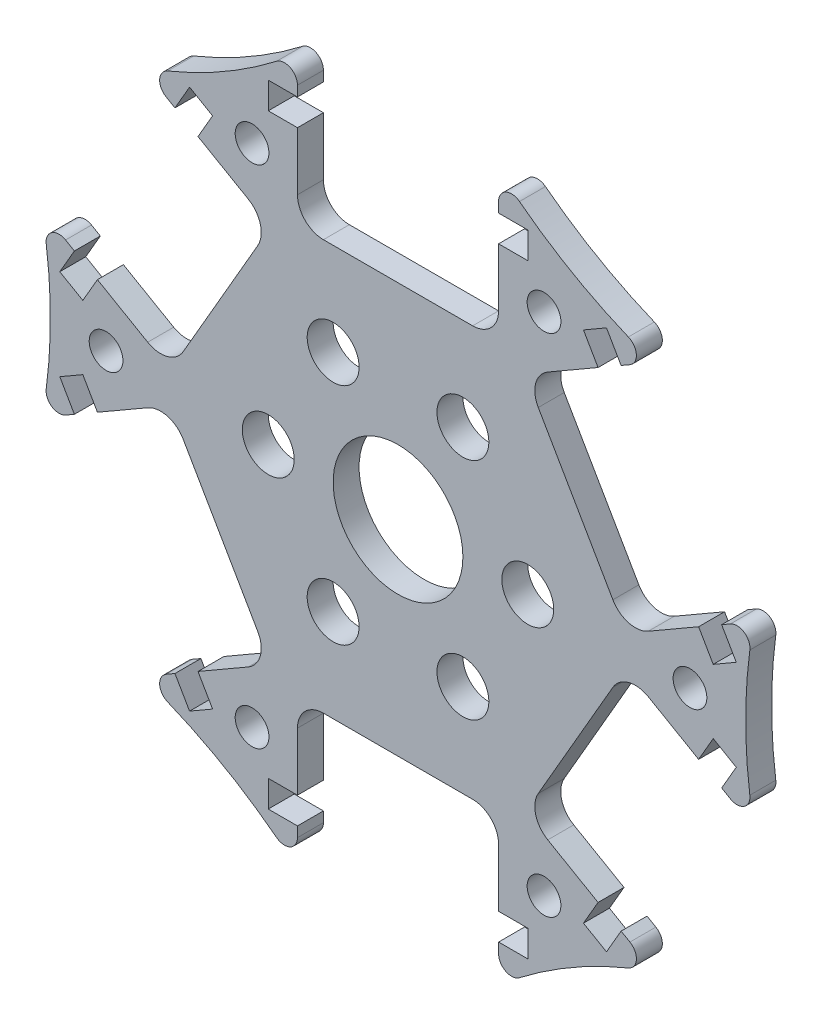
from build123d import *

# Parameters (mm, degrees)
SKETCH_1_R          = 28.3
EXTRUDE_1_DEPTH     = 2
SKETCH_2_R          = 5
SKETCH_2_R_2        = 2
SKETCH_2_R_3        = 1.3
CUT_EXTRUDE_1_DEPTH = 41.072184867
CUT_EXTRUDE_3_DEPTH = 40.315613947
FILLET_2_R          = 2
FILLET_1_R          = 1


with BuildPart() as part:
    # ｽｹｯﾁ1 → ﾎﾞｽ - 押し出し1 (new body)
    with BuildSketch(Plane.XY):
        Circle(SKETCH_1_R)
    extrude(amount=EXTRUDE_1_DEPTH)

    # ｽｹｯﾁ2 → ｶｯﾄ - 押し出し1 (cut, through all)
    with BuildSketch(Plane.XY.offset(2)):
        Circle(SKETCH_2_R)
        with Locations((5, 8.660254038)):
            Circle(SKETCH_2_R_2)
        with Locations((10, 0)):
            Circle(SKETCH_2_R_2)
        with Locations((5, -8.660254038)):
            Circle(SKETCH_2_R_2)
        with Locations((-5, -8.660254038)):
            Circle(SKETCH_2_R_2)
        with Locations((-10, 0)):
            Circle(SKETCH_2_R_2)
        with Locations((-5, 8.660254038)):
            Circle(SKETCH_2_R_2)
        with Locations((11.25, 19.485571585)):
            Circle(SKETCH_2_R_3)
        with Locations((22.5, 0)):
            Circle(SKETCH_2_R_3)
        with Locations((11.25, -19.485571585)):
            Circle(SKETCH_2_R_3)
        with Locations((-11.25, -19.485571585)):
            Circle(SKETCH_2_R_3)
        with Locations((-22.5, 0)):
            Circle(SKETCH_2_R_3)
        with Locations((-11.25, 19.485571585)):
            Circle(SKETCH_2_R_3)
        with BuildLine():
            Line((7.75, 24.325), (10, 24.325))
            Line((10, 24.325), (10, 22.275))
            Line((10, 22.275), (7.75, 22.275))
            Line((7.75, 22.275), (7.75, 15.8))
            Line((7.75, 15.8), (-7.75, 15.8))
            Line((-7.75, 15.8), (-7.75, 22.275))
            Line((-7.75, 22.275), (-10, 22.275))
            Line((-10, 22.275), (-10, 24.325))
            Line((-10, 24.325), (-7.75, 24.325))
            Line((-7.75, 24.325), (-7.75, 27.21814652))
            ThreePointArc((-7.75, 27.21814652), (0, 28.3), (7.75, 27.21814652))
            Line((7.75, 27.21814652), (7.75, 24.325))
        make_face()
        with BuildLine():
            Line((24.941067947, 5.450803121), (26.066067947, 3.502245962))
            Line((26.066067947, 3.502245962), (24.290715869, 2.477245962))
            Line((24.290715869, 2.477245962), (23.165715869, 4.425803121))
            Line((23.165715869, 4.425803121), (17.55820138, 1.188303121))
            Line((17.55820138, 1.188303121), (9.80820138, 14.611696879))
            Line((9.80820138, 14.611696879), (15.415715869, 17.849196879))
            Line((15.415715869, 17.849196879), (14.290715869, 19.797754038))
            Line((14.290715869, 19.797754038), (16.066067947, 20.822754038))
            Line((16.066067947, 20.822754038), (17.191067947, 18.874196879))
            Line((17.191067947, 18.874196879), (19.69660633, 20.320770139))
            ThreePointArc((19.69660633, 20.320770139), (24.508518927, 14.15), (27.44660633, 6.897376381))
            Line((27.44660633, 6.897376381), (24.941067947, 5.450803121))
        make_face()
        with BuildLine():
            Line((17.191067947, -18.874196879), (16.066067947, -20.822754038))
            Line((16.066067947, -20.822754038), (14.290715869, -19.797754038))
            Line((14.290715869, -19.797754038), (15.415715869, -17.849196879))
            Line((15.415715869, -17.849196879), (9.80820138, -14.611696879))
            Line((9.80820138, -14.611696879), (17.55820138, -1.188303121))
            Line((17.55820138, -1.188303121), (23.165715869, -4.425803121))
            Line((23.165715869, -4.425803121), (24.290715869, -2.477245962))
            Line((24.290715869, -2.477245962), (26.066067947, -3.502245962))
            Line((26.066067947, -3.502245962), (24.941067947, -5.450803121))
            Line((24.941067947, -5.450803121), (27.44660633, -6.897376381))
            ThreePointArc((27.44660633, -6.897376381), (24.508518927, -14.15), (19.69660633, -20.320770139))
            Line((19.69660633, -20.320770139), (17.191067947, -18.874196879))
        make_face()
        with BuildLine():
            Line((-7.75, -24.325), (-10, -24.325))
            Line((-10, -24.325), (-10, -22.275))
            Line((-10, -22.275), (-7.75, -22.275))
            Line((-7.75, -22.275), (-7.75, -15.8))
            Line((-7.75, -15.8), (7.75, -15.8))
            Line((7.75, -15.8), (7.75, -22.275))
            Line((7.75, -22.275), (10, -22.275))
            Line((10, -22.275), (10, -24.325))
            Line((10, -24.325), (7.75, -24.325))
            Line((7.75, -24.325), (7.75, -27.21814652))
            ThreePointArc((7.75, -27.21814652), (0, -28.3), (-7.75, -27.21814652))
            Line((-7.75, -27.21814652), (-7.75, -24.325))
        make_face()
        with BuildLine():
            Line((-24.941067947, -5.450803121), (-26.066067947, -3.502245962))
            Line((-26.066067947, -3.502245962), (-24.290715869, -2.477245962))
            Line((-24.290715869, -2.477245962), (-23.165715869, -4.425803121))
            Line((-23.165715869, -4.425803121), (-17.55820138, -1.188303121))
            Line((-17.55820138, -1.188303121), (-9.80820138, -14.611696879))
            Line((-9.80820138, -14.611696879), (-15.415715869, -17.849196879))
            Line((-15.415715869, -17.849196879), (-14.290715869, -19.797754038))
            Line((-14.290715869, -19.797754038), (-16.066067947, -20.822754038))
            Line((-16.066067947, -20.822754038), (-17.191067947, -18.874196879))
            Line((-17.191067947, -18.874196879), (-19.69660633, -20.320770139))
            ThreePointArc((-19.69660633, -20.320770139), (-24.508518927, -14.15), (-27.44660633, -6.897376381))
            Line((-27.44660633, -6.897376381), (-24.941067947, -5.450803121))
        make_face()
        with BuildLine():
            Line((-17.191067947, 18.874196879), (-16.066067947, 20.822754038))
            Line((-16.066067947, 20.822754038), (-14.290715869, 19.797754038))
            Line((-14.290715869, 19.797754038), (-15.415715869, 17.849196879))
            Line((-15.415715869, 17.849196879), (-9.80820138, 14.611696879))
            Line((-9.80820138, 14.611696879), (-17.55820138, 1.188303121))
            Line((-17.55820138, 1.188303121), (-23.165715869, 4.425803121))
            Line((-23.165715869, 4.425803121), (-24.290715869, 2.477245962))
            Line((-24.290715869, 2.477245962), (-26.066067947, 3.502245962))
            Line((-26.066067947, 3.502245962), (-24.941067947, 5.450803121))
            Line((-24.941067947, 5.450803121), (-27.44660633, 6.897376381))
            ThreePointArc((-27.44660633, 6.897376381), (-24.508518927, 14.15), (-19.69660633, 20.320770139))
            Line((-19.69660633, 20.320770139), (-17.191067947, 18.874196879))
        make_face()
    extrude(amount=-CUT_EXTRUDE_1_DEPTH, mode=Mode.SUBTRACT)

    # ｽｹｯﾁ3 → ｶｯﾄ - 押し出し3 (cut, through all)
    with BuildSketch(Plane.XY.offset(2)):
        with BuildLine():
            ThreePointArc((7.75, 27.21814652), (13.394592318, 23.200114441), (19.69660633, 20.320770139))
            ThreePointArc((19.69660633, 20.320770139), (14.15, 24.508518927), (7.75, 27.21814652))
        make_face()
        with BuildLine():
            ThreePointArc((27.44660633, 6.897376381), (26.789184636, 0), (27.44660633, -6.897376381))
            ThreePointArc((27.44660633, -6.897376381), (28.3, 0), (27.44660633, 6.897376381))
        make_face()
        with BuildLine():
            ThreePointArc((19.69660633, -20.320770139), (13.394592318, -23.200114441), (7.75, -27.21814652))
            ThreePointArc((7.75, -27.21814652), (14.15, -24.508518927), (19.69660633, -20.320770139))
        make_face()
        with BuildLine():
            ThreePointArc((-7.75, -27.21814652), (-13.394592318, -23.200114441), (-19.69660633, -20.320770139))
            ThreePointArc((-19.69660633, -20.320770139), (-14.15, -24.508518927), (-7.75, -27.21814652))
        make_face()
        with BuildLine():
            ThreePointArc((-27.44660633, -6.897376381), (-26.789184636, 0), (-27.44660633, 6.897376381))
            ThreePointArc((-27.44660633, 6.897376381), (-28.3, 0), (-27.44660633, -6.897376381))
        make_face()
        with BuildLine():
            ThreePointArc((-19.69660633, 20.320770139), (-13.394592318, 23.200114441), (-7.75, 27.21814652))
            ThreePointArc((-7.75, 27.21814652), (-14.15, 24.508518927), (-19.69660633, 20.320770139))
        make_face()
    extrude(amount=-CUT_EXTRUDE_3_DEPTH, mode=Mode.SUBTRACT)

    # ﾌｨﾚｯﾄ2
    fillet_2_edges = [part.edges().sort_by_distance(p)[0] for p in [
        (9.80820138, -14.611696879, 1),
        (17.55820138, -1.188303121, 1),
        (17.55820138, 1.188303121, 1),
        (9.80820138, 14.611696879, 1),
        (7.75, 15.8, 1),
        (-7.75, 15.8, 1),
        (-9.80820138, 14.611696879, 1),
        (-17.55820138, 1.188303121, 1),
        (-7.75, -15.8, 1),
        (7.75, -15.8, 1),
        (-17.55820138, -1.188303121, 1),
        (-9.80820138, -14.611696879, 1),
    ]]
    fillet(fillet_2_edges, radius=FILLET_2_R)

    # ﾌｨﾚｯﾄ1
    fillet_1_edges = [part.edges().sort_by_distance(p)[0] for p in [
        (27.44660633, -6.897376381, 1),
        (19.69660633, -20.320770139, 1),
        (19.69660633, 20.320770139, 1),
        (27.44660633, 6.897376381, 1),
        (-7.75, 27.21814652, 1),
        (7.75, 27.21814652, 1),
        (-27.44660633, 6.897376381, 1),
        (-19.69660633, 20.320770139, 1),
        (7.75, -27.21814652, 1),
        (-7.75, -27.21814652, 1),
        (-19.69660633, -20.320770139, 1),
        (-27.44660633, -6.897376381, 1),
    ]]
    fillet(fillet_1_edges, radius=FILLET_1_R)


solid = part.part
